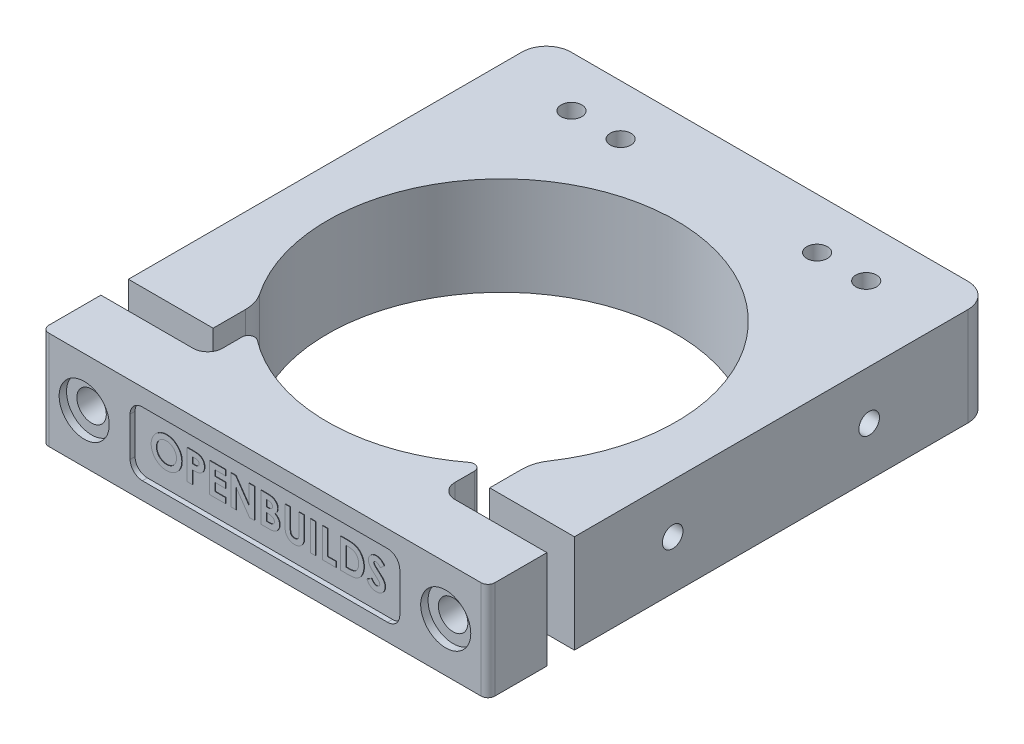
from build123d import *

# Parameters (mm, degrees)
BOSS_EXTRUDE1_DEPTH            = 20
BOSS_EXTRUDE1_2_DEPTH          = 20
SKETCH2_W                      = 2.1
SKETCH2_H                      = 20
M5X0_8_TAPPED_HOLE1_AT_2_COUNT = 2
M5X0_8_TAPPED_HOLE1_AT_2_PITCH = 10
M5X0_8_TAPPED_HOLE1_AT_3_COUNT = 2
M5X0_8_TAPPED_HOLE1_AT_3_PITCH = 50
M5X0_8_TAPPED_HOLE1_AT_4_COUNT = 2
M5X0_8_TAPPED_HOLE1_AT_4_PITCH = 60
HOLE1_AT_2_COUNT               = 2
HOLE1_AT_2_PITCH               = 73.6
M5X0_8_TAPPED_HOLE2_AT_2_COUNT = 2
M5X0_8_TAPPED_HOLE2_AT_2_PITCH = 73.6
M5X0_8_TAPPED_HOLE3_AT_2_COUNT = 2
M5X0_8_TAPPED_HOLE3_AT_2_PITCH = 40
M5X0_8_TAPPED_HOLE4_AT_2_COUNT = 2
M5X0_8_TAPPED_HOLE4_AT_2_PITCH = 20
M5X0_8_TAPPED_HOLE4_AT_3_COUNT = 2
M5X0_8_TAPPED_HOLE4_AT_3_PITCH = 60
M5X0_8_TAPPED_HOLE4_AT_4_COUNT = 2
M5X0_8_TAPPED_HOLE4_AT_4_PITCH = 40
CUT_EXTRUDE1_DEPTH             = 1
SKETCH13_W                     = 1.076923077
SKETCH13_H                     = 6
BOSS_EXTRUDE2_DEPTH            = 0.1


with BuildPart() as part:
    # Sketch1 → Boss-Extrude1 (new body)
    with BuildSketch(Plane(origin=(0, 0, 0), x_dir=(1, 0, 0), z_dir=(0, 1, 0))):
        with BuildLine():
            Line((-45.4, -30.6), (-28.15, -30.6))
            Line((-28.15, -30.6), (-28.15, -24.043242294))
            ThreePointArc((-28.15, -24.043242294), (-28.477651207, -21.850660986), (-29.431976744, -19.849653522))
            ThreePointArc((-29.431976744, -19.849653522), (0, 35.5), (29.431976744, -19.849653522))
            ThreePointArc((29.431976744, -19.849653522), (28.477651207, -21.850660986), (28.15, -24.043242294))
            Line((28.15, -24.043242294), (28.15, -30.6))
            Line((28.15, -30.6), (45.4, -30.6))
            Line((45.4, -30.6), (45.4, 49.5))
            ThreePointArc((45.4, 49.5), (43.935533906, 53.035533906), (40.4, 54.5))
            Line((40.4, 54.5), (-40.4, 54.5))
            ThreePointArc((-40.4, 54.5), (-43.935533906, 53.035533906), (-45.4, 49.5))
            Line((-45.4, 49.5), (-45.4, -30.6))
        make_face()
    extrude(amount=BOSS_EXTRUDE1_DEPTH)

    # Sketch2 → M5x0.8 Tapped Hole1 (revolve, cut)
    with BuildSketch(Plane(origin=(-30, 20, -44.2), x_dir=(0, 0, 1), z_dir=(1, 0, 0))):
        with Locations((1.05, 10)):
            Rectangle(SKETCH2_W, SKETCH2_H)
    m5x0_8_tapped_hole1 = revolve(axis=Axis((-30, 26.35, -44.2), (0, -1, 0)), mode=Mode.SUBTRACT)

    # M5x0.8 Tapped Hole1 at 2: M5x0.8 Tapped Hole1 ×2
    with Locations(*[(i * M5X0_8_TAPPED_HOLE1_AT_2_PITCH, 0, 0) for i in range(1, M5X0_8_TAPPED_HOLE1_AT_2_COUNT)]):
        add(m5x0_8_tapped_hole1, mode=Mode.SUBTRACT)

    # M5x0.8 Tapped Hole1 at 3: M5x0.8 Tapped Hole1 ×2
    with Locations(*[(i * M5X0_8_TAPPED_HOLE1_AT_3_PITCH, 0, 0) for i in range(1, M5X0_8_TAPPED_HOLE1_AT_3_COUNT)]):
        add(m5x0_8_tapped_hole1, mode=Mode.SUBTRACT)

    # M5x0.8 Tapped Hole1 at 4: M5x0.8 Tapped Hole1 ×2
    with Locations(*[(i * M5X0_8_TAPPED_HOLE1_AT_4_PITCH, 0, 0) for i in range(1, M5X0_8_TAPPED_HOLE1_AT_4_COUNT)]):
        add(m5x0_8_tapped_hole1, mode=Mode.SUBTRACT)

    # Sketch6 → M5x0.8 Tapped Hole2 (revolve, cut)
    with BuildSketch(Plane(origin=(36.8, 10, 30.6), x_dir=(0, -1, 0), z_dir=(1, 0, 0))):
        Polygon((0, 0), (0, 14.2618073), (2.1, 13), (2.1, 0), align=None)
    m5x0_8_tapped_hole2 = revolve(axis=Axis((36.8, 10, 36.95), (0, 0, -1)), mode=Mode.SUBTRACT)

    # M5x0.8 Tapped Hole2 at 2: M5x0.8 Tapped Hole2 ×2
    with Locations(*[(-i * M5X0_8_TAPPED_HOLE2_AT_2_PITCH, 0, 0) for i in range(1, M5X0_8_TAPPED_HOLE2_AT_2_COUNT)]):
        add(m5x0_8_tapped_hole2, mode=Mode.SUBTRACT)

    # Sketch8 → M5x0.8 Tapped Hole3 (revolve, cut)
    with BuildSketch(Plane(origin=(45.4, 10, 10.6), x_dir=(0, 0, -1), z_dir=(0, 1, 0))):
        Polygon((0, 0), (0, 10.2618073), (2.1, 9), (2.1, 0), align=None)
    m5x0_8_tapped_hole3 = revolve(axis=Axis((51.75, 10, 10.6), (-1, 0, 0)), mode=Mode.SUBTRACT)

    # M5x0.8 Tapped Hole3 at 2: M5x0.8 Tapped Hole3 ×2
    with Locations(*[(0, 0, -i * M5X0_8_TAPPED_HOLE3_AT_2_PITCH) for i in range(1, M5X0_8_TAPPED_HOLE3_AT_2_COUNT)]):
        add(m5x0_8_tapped_hole3, mode=Mode.SUBTRACT)

    # Mirror1: M5x0.8 Tapped Hole3 across plane
    add(m5x0_8_tapped_hole3.mirror(Plane(origin=(0, 0, 0), x_dir=(0, 0, 1), z_dir=(1, 0, 0))), mode=Mode.SUBTRACT)

    # Mirror1 copy 1 sketch → Mirror1 copy 1 (revolve, cut)
    with BuildSketch(Plane(origin=(-45.4, 10, -29.4), x_dir=(0, 0, -1), z_dir=(0, 1, 0))):
        Polygon((0, 0), (0, -10.2618073), (2.1, -9), (2.1, 0), align=None)
    revolve(axis=Axis((-51.75, 10, -29.4), (-1, 0, 0)), mode=Mode.SUBTRACT)

    # Sketch10 → M5x0.8 Tapped Hole4 (revolve, cut)
    with BuildSketch(Plane(origin=(30, 10, -54.5), x_dir=(0, 1, 0), z_dir=(1, 0, 0))):
        Polygon((0, 0), (0, 8.2618073), (2.1, 7), (2.1, 0), align=None)
    m5x0_8_tapped_hole4 = revolve(axis=Axis((30, 10, -60.85), (0, 0, 1)), mode=Mode.SUBTRACT)

    # M5x0.8 Tapped Hole4 at 2: M5x0.8 Tapped Hole4 ×2
    with Locations(*[(-i * M5X0_8_TAPPED_HOLE4_AT_2_PITCH, 0, 0) for i in range(1, M5X0_8_TAPPED_HOLE4_AT_2_COUNT)]):
        add(m5x0_8_tapped_hole4, mode=Mode.SUBTRACT)

    # M5x0.8 Tapped Hole4 at 3: M5x0.8 Tapped Hole4 ×2
    with Locations(*[(-i * M5X0_8_TAPPED_HOLE4_AT_3_PITCH, 0, 0) for i in range(1, M5X0_8_TAPPED_HOLE4_AT_3_COUNT)]):
        add(m5x0_8_tapped_hole4, mode=Mode.SUBTRACT)

    # M5x0.8 Tapped Hole4 at 4: M5x0.8 Tapped Hole4 ×2
    with Locations(*[(-i * M5X0_8_TAPPED_HOLE4_AT_4_PITCH, 0, 0) for i in range(1, M5X0_8_TAPPED_HOLE4_AT_4_COUNT)]):
        add(m5x0_8_tapped_hole4, mode=Mode.SUBTRACT)


with BuildPart() as body_2:
    # Sketch1 → Boss-Extrude1 2 (new body)
    with BuildSketch(Plane(origin=(0, 0, 0), x_dir=(1, 0, 0), z_dir=(0, 1, 0))):
        with BuildLine():
            Line((-23.65, -29.235551987), (-23.65, -33.2))
            ThreePointArc((-23.65, -33.2), (-24.528679656, -35.321320344), (-26.65, -36.2))
            Line((-26.65, -36.2), (-45.4, -36.2))
            Line((-45.4, -36.2), (-45.4, -46.8))
            ThreePointArc((-45.4, -46.8), (-44.989949494, -47.789949494), (-44, -48.2))
            Line((-44, -48.2), (44, -48.2))
            ThreePointArc((44, -48.2), (44.989949494, -47.789949494), (45.4, -46.8))
            Line((45.4, -46.8), (45.4, -36.2))
            Line((45.4, -36.2), (26.65, -36.2))
            ThreePointArc((26.65, -36.2), (24.528679656, -35.321320344), (23.65, -33.2))
            Line((23.65, -33.2), (23.65, -29.235551987))
            ThreePointArc((23.65, -29.235551987), (22.926021069, -28.070133724), (21.560461957, -28.202774336))
            ThreePointArc((21.560461957, -28.202774336), (0, -35.5), (-21.560461957, -28.202774336))
            ThreePointArc((-21.560461957, -28.202774336), (-22.926021069, -28.070133724), (-23.65, -29.235551987))
        make_face()
    extrude(amount=BOSS_EXTRUDE1_2_DEPTH)

    # Sketch4 → Hole1 (revolve, cut)
    with BuildSketch(Plane(origin=(36.8, 10, 48.2), x_dir=(0, -1, 0), z_dir=(1, 0, 0))):
        Polygon((0, 0), (0, 12), (3, 12), (3, 1.5), (5.1, 1.5), (5.1, 0), align=None)
    hole1 = revolve(axis=Axis((36.8, 10, -61.8), (0, 0, 1)), mode=Mode.SUBTRACT)

    # Hole1 at 2: Hole1 ×2
    with Locations(*[(-i * HOLE1_AT_2_PITCH, 0, 0) for i in range(1, HOLE1_AT_2_COUNT)]):
        add(hole1, mode=Mode.SUBTRACT)

    # Sketch12 → Cut-Extrude1 (cut)
    with BuildSketch(Plane.XY.offset(48.2)):
        with BuildLine():
            Line((-24.95, 16.5), (24.95, 16.5))
            ThreePointArc((24.95, 16.5), (26.717766953, 15.767766953), (27.45, 14))
            Line((27.45, 14), (27.45, 6))
            ThreePointArc((27.45, 6), (26.717766953, 4.232233047), (24.95, 3.5))
            Line((24.95, 3.5), (-24.95, 3.5))
            ThreePointArc((-24.95, 3.5), (-26.717766953, 4.232233047), (-27.45, 6))
            Line((-27.45, 6), (-27.45, 14))
            ThreePointArc((-27.45, 14), (-26.717766953, 15.767766953), (-24.95, 16.5))
        make_face()
    extrude(amount=-CUT_EXTRUDE1_DEPTH, mode=Mode.SUBTRACT)

    # Sketch13 → Boss-Extrude2 (add)
    # profile 1 of 10: a face of its own
    with BuildSketch(Plane.XY.offset(47.2)):
        with BuildLine():
            add(Edge.make_bspline(
                [(-20.937980769, 13.153846154), (-20.833663416, 13.151145191), (-20.627717333, 13.145812878), (-20.324844963, 13.101363888), (-20.032971434, 13.028940632), (-19.75222873, 12.928267067), (-19.483319798, 12.796616443), (-19.225296106, 12.63772114), (-18.979081884, 12.448582105), (-18.747200137, 12.233611639), (-18.532899583, 11.999840645), (-18.347208027, 11.748144608), (-18.18885708, 11.485045226), (-18.057615392, 11.209837517), (-17.957650418, 10.920615535), (-17.887500861, 10.618853931), (-17.842433246, 10.304638552), (-17.837249777, 10.090700708), (-17.834615385, 9.981971154)],
                knots=[0, 0, 0, 0, 1.014329547, 2.002516266, 2.970391464, 3.935626869, 4.897733899, 5.877609409, 6.878433252, 7.912639331, 8.949961323, 9.958554974, 10.949718813, 11.932905612, 12.9188844, 13.919928257, 14.942845884, 16, 16, 16, 16], degree=3))
            add(Edge.make_bspline(
                [(-17.834615385, 9.981971154), (-17.837420899, 9.874466731), (-17.842949255, 9.662625816), (-17.885661004, 9.351306056), (-17.956991888, 9.052776947), (-18.055261377, 8.766362762), (-18.184122838, 8.493450793), (-18.339385768, 8.232298534), (-18.525147263, 7.985329542), (-18.734631871, 7.752676349), (-18.965256244, 7.541493654), (-19.209524067, 7.355389269), (-19.466307461, 7.197691436), (-19.735230577, 7.068472389), (-20.016870108, 6.968190245), (-20.31053037, 6.897433906), (-20.616193192, 6.85443385), (-20.824058733, 6.848941605), (-20.929567308, 6.846153846)],
                knots=[0, 0, 0, 0, 1.051557043, 2.072126891, 3.067553643, 4.050577992, 5.02905126, 6.015227836, 7.017913613, 8.04756643, 9.074058332, 10.072836633, 11.047628519, 12.017157415, 12.98668631, 13.966869689, 14.968021931, 16, 16, 16, 16], degree=3))
            add(Edge.make_bspline(
                [(-20.929567308, 6.846153846), (-21.039916625, 6.848654603), (-21.256737951, 6.853568248), (-21.574056932, 6.900294773), (-21.878075934, 6.970681242), (-22.166241023, 7.07572927), (-22.441486914, 7.207048139), (-22.701791295, 7.3687752), (-22.947066685, 7.560643185), (-23.175906146, 7.777738284), (-23.383235252, 8.015287939), (-23.566243856, 8.266238084), (-23.720615673, 8.528671681), (-23.846356351, 8.802711553), (-23.945485251, 9.08665461), (-24.015409426, 9.382230147), (-24.056715306, 9.688729266), (-24.062468975, 9.896909595), (-24.065384615, 10.002403846)],
                knots=[0, 0, 0, 0, 1.067978421, 2.098431617, 3.099715153, 4.085208694, 5.062210972, 6.048429807, 7.046490867, 8.072918869, 9.098532598, 10.095778865, 11.076610158, 12.041847152, 13.011192615, 13.984257998, 14.978533688, 16, 16, 16, 16], degree=3))
            add(Edge.make_bspline(
                [(-24.065384615, 10.002403846), (-24.064469519, 10.073374856), (-24.062650915, 10.214418219), (-24.040743905, 10.423437283), (-24.009204109, 10.628376576), (-23.962558248, 10.828419002), (-23.905895448, 11.024975766), (-23.832480788, 11.216217271), (-23.748915036, 11.4041865), (-23.651276323, 11.586663302), (-23.542711516, 11.761968738), (-23.424257644, 11.929275862), (-23.295616859, 12.086561686), (-23.157203555, 12.234859827), (-23.00854074, 12.373195511), (-22.85158392, 12.503527073), (-22.683289048, 12.622392443), (-22.507339569, 12.732694549), (-22.324727447, 12.832438831), (-22.136196078, 12.91733818), (-21.945629581, 12.991479336), (-21.750482245, 13.049994815), (-21.55284542, 13.09765506), (-21.350607758, 13.129173598), (-21.14559636, 13.151080001), (-21.007350204, 13.152921915), (-20.937980769, 13.153846154)],
                knots=[0, 0, 0, 0, 1.034744296, 2.056386356, 3.06226378, 4.057406941, 5.050368692, 6.043467995, 7.042652155, 8.049140477, 9.059438543, 10.048523776, 11.036952808, 12.020949711, 13.004946614, 13.997082645, 14.994316842, 16.007702937, 17.024872941, 18.026463647, 19.021641123, 20.005082605, 20.995858141, 21.984425357, 22.988620895, 24, 24, 24, 24], degree=3))
        make_face()
        with BuildLine():
            add(Edge.make_bspline(
                [(-20.954807692, 12.076923077), (-21.025013257, 12.075039304), (-21.163570949, 12.07132149), (-21.366809849, 12.042996776), (-21.56192637, 11.997758988), (-21.747838905, 11.932232606), (-21.925353215, 11.848834151), (-22.094783976, 11.747855029), (-22.253784924, 11.625824195), (-22.404476183, 11.489292941), (-22.540600939, 11.337165746), (-22.660871455, 11.174135586), (-22.761518505, 11.000474717), (-22.84581104, 10.817796407), (-22.909264637, 10.624046488), (-22.954460731, 10.420742624), (-22.983022976, 10.207534511), (-22.986623282, 10.062190819), (-22.988461538, 9.987980769)],
                knots=[0, 0, 0, 0, 1.033739768, 2.040188636, 3.016340934, 3.979330865, 4.937572243, 5.900995986, 6.878200029, 7.884839167, 8.891893314, 9.879764717, 10.863503415, 11.843163062, 12.837761627, 13.859916423, 14.907309254, 16, 16, 16, 16], degree=3))
            add(Edge.make_bspline(
                [(-22.988461538, 9.987980769), (-22.986024292, 9.905739341), (-22.981247692, 9.744559769), (-22.947638953, 9.509435351), (-22.890137748, 9.287383675), (-22.807107124, 9.079490762), (-22.704127368, 8.883448116), (-22.576242855, 8.70165852), (-22.425524709, 8.533033501), (-22.30941267, 8.434583191), (-22.250480769, 8.384615385)],
                knots=[0, 0, 0, 0, 1.078454662, 2.113592447, 3.107694534, 4.079536787, 5.043276885, 6.005368276, 6.987637804, 8, 8, 8, 8], degree=3))
            add(Edge.make_bspline(
                [(-22.250480769, 8.384615385), (-22.202204292, 8.347701088), (-22.106739014, 8.274704181), (-21.954355646, 8.18114367), (-21.797430783, 8.100952979), (-21.63478023, 8.036159849), (-21.466747496, 7.985194662), (-21.293355625, 7.949504579), (-21.114850296, 7.927105966), (-20.994136627, 7.924428907), (-20.933173077, 7.923076923)],
                knots=[0, 0, 0, 0, 1.023928204, 2.024787132, 3.009472467, 3.9914905, 4.972207045, 5.96565515, 6.972602802, 8, 8, 8, 8], degree=3))
            add(Edge.make_bspline(
                [(-20.933173077, 7.923076923), (-20.864174698, 7.924976668), (-20.728418218, 7.928714477), (-20.52896272, 7.956690498), (-20.337878295, 8.004036027), (-20.153978675, 8.068987589), (-19.977794143, 8.153433183), (-19.810185762, 8.257544361), (-19.650859669, 8.38004277), (-19.500360389, 8.518366979), (-19.362796933, 8.67109345), (-19.242777397, 8.834993196), (-19.138930274, 9.006455017), (-19.056390603, 9.187905695), (-18.990430098, 9.377632419), (-18.945777962, 9.57647545), (-18.916974431, 9.78361508), (-18.91337311, 9.924580918), (-18.911538462, 9.996394231)],
                knots=[0, 0, 0, 0, 1.026359118, 2.019393844, 2.989460624, 3.950973911, 4.916101784, 5.890408035, 6.881132271, 7.902007068, 8.92769091, 9.933912415, 10.920395702, 11.90457117, 12.894218921, 13.903490204, 14.931958862, 16, 16, 16, 16], degree=3))
            add(Edge.make_bspline(
                [(-18.911538462, 9.996394231), (-18.913436589, 10.067794597), (-18.917172764, 10.20833533), (-18.945198025, 10.414942405), (-18.9922433, 10.612907602), (-19.057389905, 10.802554218), (-19.14057867, 10.984068178), (-19.243450016, 11.156811172), (-19.365642982, 11.320616198), (-19.504345304, 11.474366989), (-19.655314257, 11.615654117), (-19.817394512, 11.738265661), (-19.986050882, 11.844811194), (-20.165153167, 11.928274662), (-20.351037085, 11.99476983), (-20.544836909, 12.043737826), (-20.747286667, 12.071122508), (-20.885017424, 12.074972319), (-20.954807692, 12.076923077)],
                knots=[0, 0, 0, 0, 1.055025985, 2.07665775, 3.074803781, 4.057872707, 5.035505728, 6.020516407, 7.023567878, 8.050795229, 9.077271434, 10.074415901, 11.050397877, 12.019801805, 12.988065821, 13.964604439, 14.968634123, 16, 16, 16, 16], degree=3))
        make_face(mode=Mode.SUBTRACT)
    # profile 2 of 10: a face of its own
    with BuildSketch(Plane.XY.offset(47.2)):
        with BuildLine():
            Line((-16.757692308, 13), (-15.555769231, 13))
            add(Edge.make_bspline(
                [(-15.555769231, 13), (-15.477237136, 12.999648474), (-15.325732264, 12.998970306), (-15.107249774, 12.990746616), (-14.90568898, 12.976009263), (-14.721096189, 12.957796225), (-14.553547302, 12.932262255), (-14.402832497, 12.902989558), (-14.268920498, 12.867326893), (-14.150301247, 12.824995803), (-14.0438443, 12.775089103), (-13.943101694, 12.721934905), (-13.850350221, 12.658497244), (-13.760908434, 12.591613162), (-13.679889876, 12.514893249), (-13.602240122, 12.433443325), (-13.531247852, 12.344033154), (-13.466584114, 12.247745023), (-13.40792414, 12.146357923), (-13.356674862, 12.039690606), (-13.315104318, 11.92757428), (-13.280231801, 11.810734212), (-13.252221855, 11.689175493), (-13.233577544, 11.562150526), (-13.22091339, 11.430546248), (-13.219795953, 11.340976294), (-13.219230769, 11.295673077)],
                knots=[0, 0, 0, 0, 1.698747864, 3.27724071, 4.728299578, 6.070144658, 7.288476769, 8.393259625, 9.389771311, 10.283485332, 11.113357557, 11.931608583, 12.74405601, 13.541433047, 14.344816069, 15.154114104, 15.974336324, 16.810834471, 17.661136416, 18.50621059, 19.367396281, 20.244825668, 21.142564693, 22.063065223, 23.020325768, 24, 24, 24, 24], degree=3))
            add(Edge.make_bspline(
                [(-13.219230769, 11.295673077), (-13.220048519, 11.245555207), (-13.221655499, 11.147067433), (-13.237409075, 11.00269644), (-13.264321161, 10.865051769), (-13.29949385, 10.732972639), (-13.348539663, 10.608632043), (-13.404572201, 10.489063176), (-13.473509997, 10.377618384), (-13.552282448, 10.272903626), (-13.638310952, 10.174067521), (-13.733637822, 10.083963775), (-13.836446085, 10.001978153), (-13.946140622, 9.927251441), (-14.06313326, 9.859934378), (-14.187339582, 9.799396612), (-14.319607739, 9.747574329), (-14.411715304, 9.720471694), (-14.458413462, 9.706730769)],
                knots=[0, 0, 0, 0, 1.102006807, 2.165578795, 3.188629044, 4.184801286, 5.166646146, 6.124351954, 7.085497154, 8.042432466, 9.003981491, 9.963833307, 10.922997304, 11.89326795, 12.880200226, 13.889073926, 14.929769137, 16, 16, 16, 16], degree=3))
            add(Edge.make_bspline(
                [(-14.458413462, 9.706730769), (-14.489171555, 9.699078106), (-14.555803489, 9.682499973), (-14.666061038, 9.665669007), (-14.793121287, 9.650193968), (-14.937395105, 9.636895046), (-15.098965669, 9.627854878), (-15.277676537, 9.620794909), (-15.473608697, 9.615661582), (-15.609852173, 9.615479429), (-15.680769231, 9.615384615)],
                knots=[0, 0, 0, 0, 0.618981996, 1.340914327, 2.176866532, 3.120127938, 4.170906482, 5.338178032, 6.614476169, 8, 8, 8, 8], degree=3))
            Line((-15.680769231, 9.615384615), (-15.680769231, 7))
            Line((-15.680769231, 7), (-16.757692308, 7))
            Line((-16.757692308, 7), (-16.757692308, 13))
        make_face()
        with BuildLine():
            Line((-15.680769231, 10.692307692), (-15.299759615, 10.692307692))
            add(Edge.make_bspline(
                [(-15.299759615, 10.692307692), (-15.230428901, 10.692747303), (-15.102859355, 10.693556193), (-14.928644406, 10.705253211), (-14.788641921, 10.723116921), (-14.678037358, 10.748737613), (-14.59070458, 10.787620405), (-14.515385526, 10.832600473), (-14.45078245, 10.889476535), (-14.394845696, 10.954467167), (-14.350125946, 11.02914466), (-14.319115129, 11.112293038), (-14.298971112, 11.202165262), (-14.297110625, 11.264710381), (-14.296153846, 11.296875)],
                knots=[0, 0, 0, 0, 1.8619151, 3.425951444, 4.686033666, 5.651700536, 6.461346321, 7.243864085, 7.999046032, 8.762387399, 9.539336099, 10.322741239, 11.137448474, 12, 12, 12, 12], degree=3))
            add(Edge.make_bspline(
                [(-14.296153846, 11.296875), (-14.297100783, 11.324976808), (-14.298938069, 11.379501073), (-14.312435272, 11.458193112), (-14.33394593, 11.531550325), (-14.365114046, 11.598806594), (-14.405407041, 11.65984764), (-14.454532355, 11.714649416), (-14.511859614, 11.764385549), (-14.55611961, 11.790711645), (-14.578605769, 11.804086538)],
                knots=[0, 0, 0, 0, 1.102301479, 2.1387299, 3.123554645, 4.094223062, 5.036071848, 5.982632524, 6.975082478, 8, 8, 8, 8], degree=3))
            add(Edge.make_bspline(
                [(-14.578605769, 11.804086538), (-14.597652844, 11.81371919), (-14.637979404, 11.834113488), (-14.706659445, 11.85782335), (-14.785915164, 11.877825231), (-14.876281626, 11.894426599), (-14.977398333, 11.907310984), (-15.089247245, 11.917164316), (-15.211992957, 11.921126725), (-15.297355256, 11.922408927), (-15.341826923, 11.923076923)],
                knots=[0, 0, 0, 0, 0.656809284, 1.390599849, 2.23162475, 3.173112763, 4.218524733, 5.370385145, 6.63003504, 8, 8, 8, 8], degree=3))
            Line((-15.341826923, 11.923076923), (-15.680769231, 11.923076923))
            Line((-15.680769231, 11.923076923), (-15.680769231, 10.692307692))
        make_face(mode=Mode.SUBTRACT)
    # profile 3 of 10: a face of its own
    with BuildSketch(Plane.XY.offset(47.2)):
        Polygon((-12.142307692, 13), (-8.911538462, 13), (-8.911538462, 11.923076923), (-11.065384615, 11.923076923), (-11.065384615, 10.769230769), (-8.911538462, 10.769230769), (-8.911538462, 9.692307692), (-11.065384615, 9.692307692), (-11.065384615, 8.076923077), (-8.911538462, 8.076923077), (-8.911538462, 7), (-12.142307692, 7), align=None)
    # profile 4 of 10: a face of its own
    with BuildSketch(Plane.XY.offset(47.2)):
        Polygon((-7.834615385, 13), (-6.864663462, 13), (-4.142307692, 9.051682692), (-4.142307692, 13), (-3.065384615, 13), (-3.065384615, 7), (-4.042548077, 7), (-6.757692308, 10.936298077), (-6.757692308, 7), (-7.834615385, 7), align=None)
    # profile 5 of 10: a face of its own
    with BuildSketch(Plane.XY.offset(47.2)):
        with BuildLine():
            Line((-1.680769231, 7), (-1.680769231, 13))
            Line((-1.680769231, 13), (-0.719230769, 13))
            add(Edge.make_bspline(
                [(-0.719230769, 13), (-0.651917065, 13.000007682), (-0.521666323, 13.000022547), (-0.333748494, 12.99342349), (-0.159470578, 12.98488687), (0.000612805, 12.975336378), (0.146774129, 12.958878971), (0.278791131, 12.941534662), (0.396927582, 12.920618495), (0.46996493, 12.901856045), (0.504326923, 12.893028846)],
                knots=[0, 0, 0, 0, 1.311965854, 2.538629056, 3.664479157, 4.713267157, 5.663616078, 6.530575999, 7.308677837, 8, 8, 8, 8], degree=3))
            add(Edge.make_bspline(
                [(0.504326923, 12.893028846), (0.549447709, 12.880577925), (0.637989176, 12.856145221), (0.764808812, 12.806802319), (0.885114927, 12.751954185), (0.998760631, 12.689382723), (1.105048094, 12.618332519), (1.203573386, 12.538239698), (1.296461456, 12.452319182), (1.380414059, 12.35817639), (1.456293381, 12.258697092), (1.522218906, 12.153907354), (1.579499738, 12.045409478), (1.625339408, 11.931838092), (1.659878737, 11.813716223), (1.685140659, 11.691548268), (1.701513805, 11.56494766), (1.703060852, 11.478817128), (1.703846154, 11.435096154)],
                knots=[0, 0, 0, 0, 1.099996261, 2.158545794, 3.195537121, 4.207578794, 5.205712374, 6.197378256, 7.190519799, 8.17788031, 9.159561366, 10.129234751, 11.085776129, 12.040971148, 13.00380137, 13.975669004, 14.972423361, 16, 16, 16, 16], degree=3))
            add(Edge.make_bspline(
                [(1.703846154, 11.435096154), (1.701792824, 11.378926178), (1.697751097, 11.268362483), (1.671932267, 11.105964419), (1.623517938, 10.952474905), (1.560168966, 10.80506519), (1.474034169, 10.664285111), (1.364659636, 10.530201607), (1.233816876, 10.398686045), (1.133453257, 10.319851336), (1.08125, 10.278846154)],
                knots=[0, 0, 0, 0, 0.986156485, 1.941127874, 2.875419072, 3.804401753, 4.751181392, 5.761612777, 6.835722519, 8, 8, 8, 8], degree=3))
            add(Edge.make_bspline(
                [(1.08125, 10.278846154), (1.123553015, 10.257250832), (1.206497523, 10.21490838), (1.324254357, 10.145310028), (1.433284331, 10.071283355), (1.534076302, 9.994317806), (1.624516044, 9.911150699), (1.708337965, 9.826574239), (1.781406727, 9.735742545), (1.846747016, 9.641893033), (1.903539734, 9.543666749), (1.952999928, 9.441229577), (1.99477718, 9.334231568), (2.030155238, 9.223217256), (2.056540202, 9.107804804), (2.07374376, 8.987952935), (2.08691588, 8.864070405), (2.087940547, 8.779684719), (2.088461538, 8.736778846)],
                knots=[0, 0, 0, 0, 1.164658916, 2.283573913, 3.35186032, 4.395461096, 5.390182219, 6.362969632, 7.312859996, 8.245001507, 9.165155236, 10.092416118, 11.032087915, 11.979892451, 12.947605196, 13.931445124, 14.948243989, 16, 16, 16, 16], degree=3))
            add(Edge.make_bspline(
                [(2.088461538, 8.736778846), (2.085080651, 8.654831082), (2.078408483, 8.493107499), (2.029624848, 8.255660137), (1.945049524, 8.030538501), (1.831482305, 7.818637321), (1.69154564, 7.626090788), (1.530658605, 7.457421697), (1.350440963, 7.314647056), (1.184168407, 7.21828525), (1.040355739, 7.153617467), (0.921238393, 7.113635765), (0.793308889, 7.076596777), (0.654223865, 7.050587235), (0.506504742, 7.026780442), (0.348711251, 7.012081635), (0.181138304, 7.002120616), (0.06604196, 7.000721163), (0.006730769, 7)],
                knots=[0, 0, 0, 0, 1.284142165, 2.534249414, 3.780121997, 5.041676246, 6.291546858, 7.49970053, 8.684500223, 9.883330709, 10.50184324, 11.153274765, 11.851151195, 12.587658647, 13.369265475, 14.195992086, 15.070362669, 16, 16, 16, 16], degree=3))
            Line((0.006730769, 7), (-1.680769231, 7))
        make_face()
        with BuildLine():
            Line((-0.603846154, 11.923076923), (-0.603846154, 10.615384615))
            Line((-0.603846154, 10.615384615), (-0.317788462, 10.615384615))
            add(Edge.make_bspline(
                [(-0.317788462, 10.615384615), (-0.278910651, 10.615723645), (-0.203859391, 10.61637812), (-0.095455806, 10.624807536), (0.005342021, 10.639188643), (0.098151786, 10.659253904), (0.183838046, 10.684733861), (0.261853413, 10.715391736), (0.331854866, 10.752797677), (0.413180364, 10.808515476), (0.49914728, 10.890506711), (0.57482299, 11.008960039), (0.619395477, 11.145180915), (0.62435965, 11.241254424), (0.626923077, 11.290865385)],
                knots=[0, 0, 0, 0, 1.065314748, 2.056525647, 2.977365736, 3.853934255, 4.656397591, 5.425096493, 6.14721249, 6.826394842, 8.123232004, 9.372140726, 10.643011755, 12, 12, 12, 12], degree=3))
            add(Edge.make_bspline(
                [(0.626923077, 11.290865385), (0.624871866, 11.337334292), (0.620905933, 11.427180057), (0.576027169, 11.553331513), (0.506321576, 11.665127521), (0.424024326, 11.741642746), (0.346525473, 11.793900389), (0.280166199, 11.828309821), (0.207331914, 11.859112794), (0.126612622, 11.882665497), (0.038469277, 11.900338616), (-0.056669962, 11.913317406), (-0.158969242, 11.922151322), (-0.229627572, 11.922761771), (-0.266105769, 11.923076923)],
                knots=[0, 0, 0, 0, 1.347982417, 2.606269829, 3.849316587, 5.153353503, 5.842674298, 6.568177932, 7.326619318, 8.142485038, 9.012069166, 9.942760135, 10.937925643, 12, 12, 12, 12], degree=3))
            Line((-0.266105769, 11.923076923), (-0.603846154, 11.923076923))
        make_face(mode=Mode.SUBTRACT)
        with BuildLine():
            Line((-0.603846154, 9.615384615), (-0.603846154, 8.076923077))
            Line((-0.603846154, 8.076923077), (-0.29375, 8.076923077))
            add(Edge.make_bspline(
                [(-0.29375, 8.076923077), (-0.232443596, 8.077273318), (-0.114574383, 8.077946701), (0.054273055, 8.086082762), (0.207797589, 8.100746578), (0.345592435, 8.119053172), (0.467868653, 8.143855743), (0.574212919, 8.175389034), (0.666083609, 8.210081146), (0.74292986, 8.252930024), (0.805708845, 8.302795491), (0.862360296, 8.353759197), (0.90855036, 8.412550647), (0.9450968, 8.476646086), (0.97672768, 8.544453338), (0.995805193, 8.618620251), (1.010330142, 8.696948697), (1.011129488, 8.751126789), (1.011538462, 8.778846154)],
                knots=[0, 0, 0, 0, 1.753078804, 3.370512758, 4.83203934, 6.162291463, 7.344201807, 8.395507345, 9.331626367, 10.147333109, 10.898971645, 11.62040215, 12.321813352, 13.025280112, 13.727906689, 14.453419512, 15.208716525, 16, 16, 16, 16], degree=3))
            add(Edge.make_bspline(
                [(1.011538462, 8.778846154), (1.010636558, 8.810543684), (1.008879894, 8.872281944), (0.994533191, 8.962519001), (0.968460545, 9.046761281), (0.935620776, 9.127162973), (0.889922492, 9.200845416), (0.835611643, 9.270358479), (0.769990273, 9.333348237), (0.696195214, 9.393624545), (0.610120584, 9.446399718), (0.511725999, 9.492191529), (0.400476927, 9.530435163), (0.276028761, 9.56088477), (0.138927072, 9.58672693), (-0.011828831, 9.602157552), (-0.1749834, 9.613633984), (-0.288117434, 9.614787812), (-0.346634615, 9.615384615)],
                knots=[0, 0, 0, 0, 0.845221588, 1.646264278, 2.427170338, 3.19324141, 3.95557735, 4.731569926, 5.540061037, 6.376114724, 7.268642756, 8.224665384, 9.265483498, 10.400594375, 11.639216012, 12.983232105, 14.439614077, 16, 16, 16, 16], degree=3))
            Line((-0.346634615, 9.615384615), (-0.603846154, 9.615384615))
        make_face(mode=Mode.SUBTRACT)
    # profile 6 of 10: a face of its own
    with BuildSketch(Plane.XY.offset(47.2)):
        with BuildLine():
            Line((3.165384615, 13), (4.242307692, 13))
            Line((4.242307692, 13), (4.242307692, 9.096153846))
            add(Edge.make_bspline(
                [(4.242307692, 9.096153846), (4.24236625, 9.055680462), (4.242479354, 8.97750654), (4.248141385, 8.865352556), (4.253322534, 8.762259562), (4.262670797, 8.668340422), (4.276481386, 8.583554963), (4.289854543, 8.507358552), (4.307953788, 8.441115399), (4.335154059, 8.365713348), (4.377060749, 8.280995026), (4.445533955, 8.192699646), (4.524546176, 8.112117297), (4.619246875, 8.045043603), (4.725682085, 7.99078703), (4.843266992, 7.950588914), (4.971835844, 7.928244098), (5.060734152, 7.924832753), (5.106490385, 7.923076923)],
                knots=[0, 0, 0, 0, 1.155499968, 2.231836252, 3.205919964, 4.102923608, 4.924856345, 5.658536265, 6.31071849, 6.882491295, 7.94666036, 8.992281882, 10.060072772, 11.158554251, 12.289267114, 13.461410017, 14.693379945, 16, 16, 16, 16], degree=3))
            add(Edge.make_bspline(
                [(5.106490385, 7.923076923), (5.155100735, 7.924495408), (5.249882688, 7.927261214), (5.386211438, 7.954410594), (5.512520798, 7.997641704), (5.626136368, 8.059343515), (5.726945083, 8.13330395), (5.812277547, 8.217642023), (5.879621615, 8.312525945), (5.923513973, 8.40006359), (5.94815737, 8.480634368), (5.966628824, 8.552621301), (5.980170443, 8.637558757), (5.992455845, 8.734120253), (5.999838425, 8.843305982), (6.00784363, 8.964237856), (6.010777612, 9.097743325), (6.011277687, 9.190705688), (6.011538462, 9.239182692)],
                knots=[0, 0, 0, 0, 1.261321664, 2.459363699, 3.594844139, 4.716940403, 5.803436589, 6.833651888, 7.818396249, 8.814403945, 9.360733334, 10.004355033, 10.743453831, 11.592799886, 12.532235708, 13.585170094, 14.740740724, 16, 16, 16, 16], degree=3))
            Line((6.011538462, 9.239182692), (6.011538462, 13))
            Line((6.011538462, 13), (7.088461538, 13))
            Line((7.088461538, 13), (7.088461538, 9.420673077))
            add(Edge.make_bspline(
                [(7.088461538, 9.420673077), (7.088311988, 9.348156085), (7.088024417, 9.208712981), (7.083608198, 9.008323427), (7.074206866, 8.825299714), (7.066310831, 8.659588362), (7.0510293, 8.511412612), (7.03510953, 8.380139711), (7.014818413, 8.26623486), (6.98462645, 8.136568031), (6.932524062, 7.987261425), (6.848528181, 7.81534134), (6.741900847, 7.647021164), (6.615872666, 7.484152534), (6.473575322, 7.332852825), (6.318163852, 7.200031265), (6.152107356, 7.087678548), (5.973670665, 6.998541833), (5.783005636, 6.929021915), (5.578225781, 6.882308031), (5.359470745, 6.850747546), (5.208372507, 6.847715772), (5.130528846, 6.846153846)],
                knots=[0, 0, 0, 0, 1.170808336, 2.251350247, 3.235597562, 4.129743112, 4.929140599, 5.639994148, 6.264258765, 6.79612947, 7.788252245, 8.809469599, 9.879094798, 10.999557536, 12.129761673, 13.226370002, 14.293821979, 15.358369427, 16.438775801, 17.562147481, 18.744053101, 20, 20, 20, 20], degree=3))
            add(Edge.make_bspline(
                [(5.130528846, 6.846153846), (5.078807969, 6.847025016), (4.976763741, 6.848743816), (4.826689801, 6.863899145), (4.681613858, 6.886232401), (4.541808508, 6.918814321), (4.406788513, 6.960904076), (4.276589746, 7.012713634), (4.151696055, 7.073954007), (4.032806329, 7.144061916), (3.920066871, 7.219871551), (3.817028826, 7.303909723), (3.720146413, 7.389961491), (3.632218524, 7.481648279), (3.552584743, 7.578007533), (3.481409075, 7.679257633), (3.418797264, 7.785389587), (3.363174345, 7.898316417), (3.315566554, 8.023777785), (3.275431398, 8.166236405), (3.240368382, 8.327925172), (3.214311617, 8.509208364), (3.190688401, 8.709488491), (3.175736207, 8.929287313), (3.167914042, 9.168611136), (3.166249062, 9.334529381), (3.165384615, 9.420673077)],
                knots=[0, 0, 0, 0, 1.001158378, 1.975264943, 2.917723546, 3.841610987, 4.75185031, 5.653588123, 6.552117133, 7.442167995, 8.324307438, 9.179605724, 10.014504199, 10.831958861, 11.636465792, 12.43274043, 13.225645099, 14.020104002, 14.867201867, 15.819789774, 16.883317127, 18.068162734, 19.364263498, 20.787406516, 22.332041935, 24, 24, 24, 24], degree=3))
            Line((3.165384615, 9.420673077), (3.165384615, 13))
        make_face()
    # profile 7 of 10: a face of its own
    with BuildSketch(Plane.XY.offset(47.2)):
        with Locations((8.857692308, 10)):
            Rectangle(SKETCH13_W, SKETCH13_H)
    # profile 8 of 10: a face of its own
    with BuildSketch(Plane.XY.offset(47.2)):
        Polygon((10.780769231, 13), (11.857692308, 13), (11.857692308, 8.076923077), (13.55, 8.076923077), (13.55, 7), (10.780769231, 7), align=None)
    # profile 9 of 10: a face of its own
    with BuildSketch(Plane.XY.offset(47.2)):
        with BuildLine():
            Line((14.473076923, 13), (15.830048077, 13))
            add(Edge.make_bspline(
                [(15.830048077, 13), (15.935839586, 12.999260481), (16.14033577, 12.997830983), (16.436610284, 12.981723975), (16.71210788, 12.956952539), (16.96700615, 12.922874941), (17.200782511, 12.877780947), (17.413135513, 12.821219369), (17.604777864, 12.755928437), (17.777810882, 12.679100407), (17.935773384, 12.589526553), (18.085763822, 12.489748472), (18.227487692, 12.376111), (18.362933865, 12.250806431), (18.490354378, 12.111542356), (18.611871241, 11.960625492), (18.724509169, 11.795867338), (18.831672962, 11.621218273), (18.928588354, 11.435938152), (19.01312158, 11.241604041), (19.083935576, 11.039466552), (19.141475614, 10.829310259), (19.187341666, 10.611832817), (19.219433218, 10.386595378), (19.239272535, 10.153806472), (19.241285068, 9.996034), (19.242307692, 9.915865385)],
                knots=[0, 0, 0, 0, 1.44355588, 2.790409838, 4.047694926, 5.217575253, 6.298404546, 7.294384826, 8.214239204, 9.058592145, 9.873746385, 10.689560431, 11.514393297, 12.350027578, 13.205127629, 14.088021785, 14.991911688, 15.926770944, 16.882954281, 17.842803888, 18.816321264, 19.80318086, 20.814351908, 21.847355356, 22.906180909, 24, 24, 24, 24], degree=3))
            add(Edge.make_bspline(
                [(19.242307692, 9.915865385), (19.23962991, 9.80274225), (19.234358538, 9.580052736), (19.189955446, 9.253258441), (19.118140612, 8.939993515), (19.017162432, 8.642708439), (18.89197652, 8.364050578), (18.742427931, 8.108933949), (18.570709394, 7.878727887), (18.37882144, 7.674578631), (18.171053521, 7.499109578), (17.955140756, 7.348833176), (17.728979762, 7.230327692), (17.52970032, 7.155177495), (17.356900181, 7.108440574), (17.205183529, 7.080818603), (17.032848893, 7.05548759), (16.838289401, 7.035912329), (16.622358544, 7.018456006), (16.384195619, 7.008970919), (16.12457173, 7.00109022), (15.944238391, 7.000372929), (15.850480769, 7)],
                knots=[0, 0, 0, 0, 1.315458931, 2.589557908, 3.828601765, 5.048913369, 6.235739168, 7.376350998, 8.481830359, 9.569842114, 10.627874879, 11.640079404, 12.624025415, 13.590060155, 14.111227486, 14.704434459, 15.382649715, 16.137166398, 16.978595427, 17.902333227, 18.909396075, 20, 20, 20, 20], degree=3))
            Line((15.850480769, 7), (14.473076923, 7))
            Line((14.473076923, 7), (14.473076923, 13))
        make_face()
        with BuildLine():
            Line((15.55, 11.923076923), (15.55, 8.076923077))
            Line((15.55, 8.076923077), (16.1125, 8.076923077))
            add(Edge.make_bspline(
                [(16.1125, 8.076923077), (16.179428861, 8.077045718), (16.308155342, 8.077281599), (16.494007243, 8.088516776), (16.665873126, 8.099793797), (16.823279886, 8.121197959), (16.96737308, 8.145040689), (17.096173246, 8.178221112), (17.212335513, 8.213074336), (17.314440983, 8.25744681), (17.407961275, 8.307390983), (17.494550382, 8.365906372), (17.578133114, 8.430885504), (17.657146823, 8.504239508), (17.731890558, 8.58499704), (17.801922087, 8.673574207), (17.868176147, 8.769700758), (17.92895212, 8.873884937), (17.984489529, 8.985026536), (18.033757435, 9.102048987), (18.074607798, 9.225926835), (18.10856012, 9.355500433), (18.132822903, 9.491897868), (18.152895729, 9.634108862), (18.163243855, 9.782696844), (18.164664071, 9.883801073), (18.165384615, 9.935096154)],
                knots=[0, 0, 0, 0, 1.50275155, 2.890291501, 4.180787663, 5.369391935, 6.45668281, 7.458360028, 8.354766181, 9.177074746, 9.954075863, 10.732690366, 11.5210699, 12.329727389, 13.151100085, 13.990027547, 14.863562427, 15.770965086, 16.696477834, 17.652329173, 18.619756807, 19.62365428, 20.657822005, 21.729286259, 22.847956731, 24, 24, 24, 24], degree=3))
            add(Edge.make_bspline(
                [(18.165384615, 9.935096154), (18.163949536, 10.013701017), (18.161151241, 10.166974409), (18.134165094, 10.390220451), (18.090236794, 10.600440043), (18.027555344, 10.796853004), (17.948543432, 10.980011357), (17.849641606, 11.148363364), (17.735106221, 11.304737106), (17.644534762, 11.396470961), (17.599278846, 11.442307692)],
                knots=[0, 0, 0, 0, 1.13821349, 2.219428113, 3.251817212, 4.244760574, 5.201143372, 6.134805572, 7.068016741, 8, 8, 8, 8], degree=3))
            add(Edge.make_bspline(
                [(17.599278846, 11.442307692), (17.554652228, 11.481366784), (17.463507412, 11.561140557), (17.303487068, 11.656729938), (17.127152937, 11.740714578), (16.930471022, 11.807305032), (16.715342167, 11.859967601), (16.480485059, 11.896287687), (16.22715741, 11.91962659), (16.051657918, 11.921902172), (15.961057692, 11.923076923)],
                knots=[0, 0, 0, 0, 0.813307809, 1.661089106, 2.549956539, 3.493439533, 4.508053171, 5.589449661, 6.755572447, 8, 8, 8, 8], degree=3))
            Line((15.961057692, 11.923076923), (15.55, 11.923076923))
        make_face(mode=Mode.SUBTRACT)
    # profile 10 of 10: a face of its own
    with BuildSketch(Plane.XY.offset(47.2)):
        with BuildLine():
            Line((23.396153846, 12.198317308), (22.590865385, 11.461538462))
            add(Edge.make_bspline(
                [(22.590865385, 11.461538462), (22.55637028, 11.510197393), (22.490144489, 11.603615755), (22.382799391, 11.728705144), (22.27593901, 11.835415702), (22.168573351, 11.923301642), (22.059750765, 11.99182899), (21.949660153, 12.04034711), (21.838925649, 12.071190539), (21.764529155, 12.075031288), (21.727884615, 12.076923077)],
                knots=[0, 0, 0, 0, 1.299362458, 2.494594718, 3.587462134, 4.587049575, 5.512617175, 6.380583204, 7.202344345, 8, 8, 8, 8], degree=3))
            add(Edge.make_bspline(
                [(21.727884615, 12.076923077), (21.69370364, 12.075724353), (21.627709156, 12.073409931), (21.533629123, 12.05040475), (21.45010353, 12.010701186), (21.377213894, 11.958785436), (21.319474548, 11.896238993), (21.273374158, 11.830643856), (21.247415765, 11.75824166), (21.243999129, 11.708512911), (21.242307692, 11.683894231)],
                knots=[0, 0, 0, 0, 1.185010067, 2.2879431, 3.333075148, 4.379039566, 5.372662701, 6.27520591, 7.14612461, 8, 8, 8, 8], degree=3))
            add(Edge.make_bspline(
                [(21.242307692, 11.683894231), (21.24336763, 11.658920538), (21.245502198, 11.608626991), (21.266119216, 11.534915534), (21.297194949, 11.46289086), (21.326889081, 11.419046014), (21.342067308, 11.396634615)],
                knots=[0, 0, 0, 0, 0.967525499, 1.948461899, 2.951351359, 4, 4, 4, 4], degree=3))
            add(Edge.make_bspline(
                [(21.342067308, 11.396634615), (21.355865958, 11.37921447), (21.387628628, 11.339115595), (21.448193535, 11.275605228), (21.524250339, 11.197799469), (21.618725865, 11.10837383), (21.727698175, 11.004112216), (21.856218275, 10.889113191), (22.000586798, 10.759815367), (22.103200599, 10.669777045), (22.156971154, 10.622596154)],
                knots=[0, 0, 0, 0, 0.473873513, 1.090794244, 1.870441696, 2.795289791, 3.865433203, 5.087734844, 6.473946851, 8, 8, 8, 8], degree=3))
            add(Edge.make_bspline(
                [(22.156971154, 10.622596154), (22.207442555, 10.578915702), (22.303226788, 10.49601928), (22.43950873, 10.378361119), (22.55927786, 10.27250694), (22.66427894, 10.180045388), (22.752920257, 10.10000633), (22.825574458, 10.03200718), (22.883128892, 9.977371756), (22.915845218, 9.944371927), (22.929807692, 9.930288462)],
                knots=[0, 0, 0, 0, 1.543621617, 2.929473131, 4.163658386, 5.240097082, 6.164993805, 6.925417477, 7.541396219, 8, 8, 8, 8], degree=3))
            add(Edge.make_bspline(
                [(22.929807692, 9.930288462), (22.982778409, 9.872962802), (23.084606728, 9.762762752), (23.216947646, 9.591987332), (23.325868502, 9.425275701), (23.410131742, 9.259490908), (23.47377073, 9.092241009), (23.518637059, 8.919424209), (23.545507803, 8.73923468), (23.548491082, 8.616277324), (23.55, 8.554086538)],
                knots=[0, 0, 0, 0, 1.206664779, 2.319633467, 3.337109185, 4.282041471, 5.190008762, 6.099243693, 7.03861361, 8, 8, 8, 8], degree=3))
            add(Edge.make_bspline(
                [(23.55, 8.554086538), (23.548925991, 8.493489245), (23.546818746, 8.374595099), (23.52100903, 8.200611226), (23.484205889, 8.034101109), (23.427301778, 7.876876613), (23.357947385, 7.726356946), (23.271001636, 7.584886725), (23.168895776, 7.451034215), (23.051866782, 7.327192192), (22.922418819, 7.214814139), (22.783573576, 7.114772543), (22.633973354, 7.032175462), (22.474896314, 6.964162658), (22.306427607, 6.911778287), (22.12876793, 6.873061354), (21.94164554, 6.849824062), (21.813688552, 6.847394878), (21.748317308, 6.846153846)],
                knots=[0, 0, 0, 0, 1.043214005, 2.046824704, 3.02475056, 3.976699089, 4.921714032, 5.875962561, 6.831408892, 7.817874052, 8.806269674, 9.781291748, 10.760897367, 11.74438705, 12.757449933, 13.795994037, 14.874007457, 16, 16, 16, 16], degree=3))
            add(Edge.make_bspline(
                [(21.748317308, 6.846153846), (21.697001437, 6.847064224), (21.595366584, 6.848867294), (21.445572176, 6.86358786), (21.300928741, 6.887345287), (21.161599209, 6.921396776), (21.026955873, 6.964544632), (20.896993206, 7.017248085), (20.772608382, 7.080324019), (20.652860247, 7.152475342), (20.538330924, 7.236252532), (20.427572235, 7.329942792), (20.321684342, 7.43498712), (20.220158685, 7.55113709), (20.123644854, 7.678721611), (20.028983605, 7.815963832), (19.940381969, 7.965410783), (19.885648797, 8.070249029), (19.857692308, 8.123798077)],
                knots=[0, 0, 0, 0, 1.016823716, 2.013894106, 2.979844003, 3.91962641, 4.853723003, 5.779685073, 6.695824784, 7.614987388, 8.547259901, 9.504950863, 10.487499108, 11.500346958, 12.559593716, 13.656357062, 14.802919212, 16, 16, 16, 16], degree=3))
            Line((19.857692308, 8.123798077), (20.804807692, 8.692307692))
            add(Edge.make_bspline(
                [(20.804807692, 8.692307692), (20.839777082, 8.631522526), (20.906816391, 8.514992167), (21.020420766, 8.35841886), (21.13680265, 8.22433974), (21.258652686, 8.115124664), (21.384489223, 8.029313287), (21.514920082, 7.967986524), (21.6500369, 7.930025327), (21.742072338, 7.925389388), (21.787980769, 7.923076923)],
                knots=[0, 0, 0, 0, 1.283663364, 2.460892379, 3.537111102, 4.529833553, 5.449777664, 6.316464042, 7.160231139, 8, 8, 8, 8], degree=3))
            add(Edge.make_bspline(
                [(21.787980769, 7.923076923), (21.834676217, 7.924965407), (21.925272185, 7.928629341), (22.054586337, 7.962471993), (22.173146448, 8.01560744), (22.275628933, 8.091424395), (22.362404639, 8.178928685), (22.426450091, 8.276281208), (22.466683876, 8.381614288), (22.470937562, 8.454785574), (22.473076923, 8.491586538)],
                knots=[0, 0, 0, 0, 1.13588714, 2.203786484, 3.234766741, 4.283437687, 5.291419208, 6.222934724, 7.106237994, 8, 8, 8, 8], degree=3))
            add(Edge.make_bspline(
                [(22.473076923, 8.491586538), (22.471101311, 8.525823847), (22.467088045, 8.595373662), (22.43752756, 8.698783052), (22.391315507, 8.802145414), (22.336643389, 8.88692602), (22.281007663, 8.957910523), (22.227807361, 9.019415384), (22.163023466, 9.087367488), (22.086820241, 9.161852313), (22.00020453, 9.243525568), (21.903103371, 9.332379256), (21.794404853, 9.427630682), (21.717576526, 9.492515012), (21.677403846, 9.526442308)],
                knots=[0, 0, 0, 0, 0.916159276, 1.861089862, 2.860218735, 3.940849679, 4.552606315, 5.27541173, 6.11797699, 7.06649574, 8.129236253, 9.306560635, 10.591630461, 12, 12, 12, 12], degree=3))
            add(Edge.make_bspline(
                [(21.677403846, 9.526442308), (21.601033984, 9.591058535), (21.454457102, 9.715076632), (21.247325372, 9.898247457), (21.060681138, 10.069437377), (20.896136458, 10.230762674), (20.751594779, 10.379244043), (20.628035, 10.516087506), (20.526814483, 10.642348623), (20.420301713, 10.791896468), (20.319093287, 10.974130792), (20.231620486, 11.19337981), (20.174871825, 11.412601008), (20.168513926, 11.559774047), (20.165384615, 11.632211538)],
                knots=[0, 0, 0, 0, 1.345494975, 2.582412109, 3.71882943, 4.751509156, 5.681369928, 6.505683931, 7.230279997, 7.856715994, 8.973648664, 10.023341002, 11.027102913, 12, 12, 12, 12], degree=3))
            add(Edge.make_bspline(
                [(20.165384615, 11.632211538), (20.166686092, 11.68358032), (20.16925014, 11.784782337), (20.192121844, 11.933585157), (20.226304477, 12.077167376), (20.275947473, 12.21500514), (20.340378089, 12.346925801), (20.418626569, 12.473575168), (20.511907963, 12.593787587), (20.617029798, 12.707483366), (20.732847145, 12.81138837), (20.856612699, 12.903094947), (20.987625936, 12.980551655), (21.125085382, 13.044807619), (21.269842818, 13.093991478), (21.42083182, 13.128855449), (21.578268957, 13.149591426), (21.685354299, 13.152410242), (21.739903846, 13.153846154)],
                knots=[0, 0, 0, 0, 1.010766082, 1.991317756, 2.957454644, 3.913069143, 4.869106762, 5.843196583, 6.838735724, 7.860187025, 8.887984031, 9.89767229, 10.887916223, 11.879572884, 12.879850636, 13.892031539, 14.926195476, 16, 16, 16, 16], degree=3))
            add(Edge.make_bspline(
                [(21.739903846, 13.153846154), (21.810597359, 13.151260035), (21.951426355, 13.14610821), (22.159646088, 13.105822624), (22.363026418, 13.042469297), (22.526914099, 12.966040477), (22.657316467, 12.892003844), (22.757257701, 12.823840238), (22.858953287, 12.745755164), (22.963223335, 12.657502555), (23.068130347, 12.557419616), (23.176657331, 12.447888901), (23.287325475, 12.327963807), (23.359242221, 12.242289876), (23.396153846, 12.198317308)],
                knots=[0, 0, 0, 0, 1.282922637, 2.555718331, 3.837320111, 5.142675274, 5.830281639, 6.55870424, 7.337177975, 8.157850921, 9.037902056, 9.96903443, 10.957596896, 12, 12, 12, 12], degree=3))
        make_face()
    extrude(amount=BOSS_EXTRUDE2_DEPTH)


solid = Compound([part.part, body_2.part])
